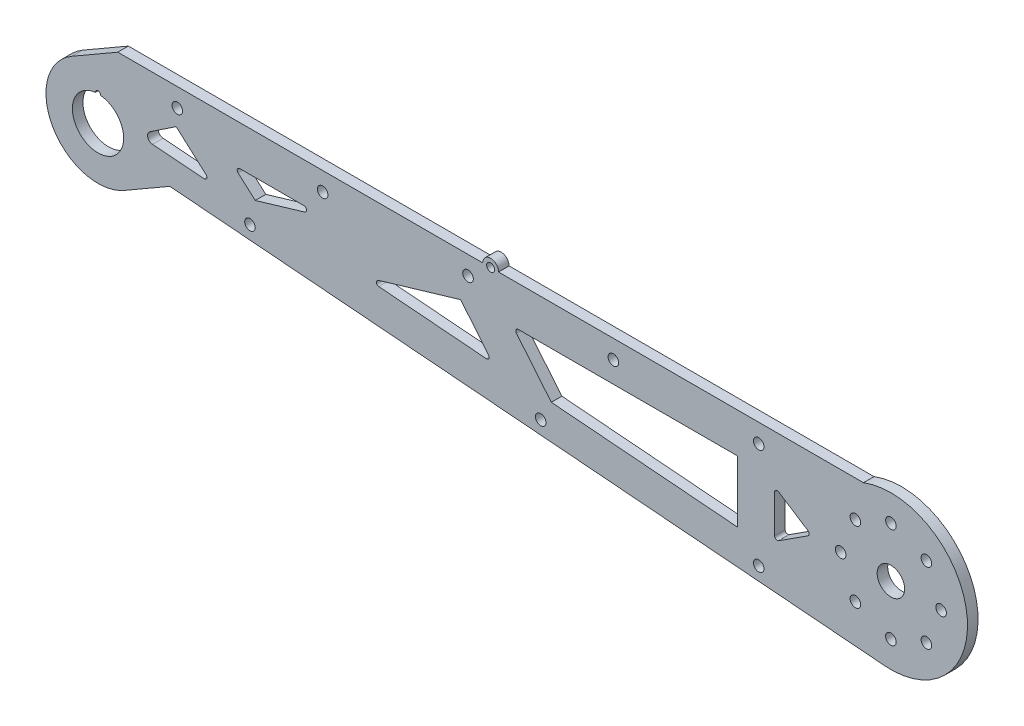
from build123d import *

# Parameters (mm, degrees)
SKETCH_1_R          = 9.7
SKETCH_1_R_2        = 5.2
SKETCH_1_R_3        = 2
EXTRUDE_1_DEPTH     = 4
CUT_EXTRUDE_1_DEPTH = 10
SKETCH_3_R          = 3
EXTRUDE_2_DEPTH     = 4
SKETCH_4_R          = 1.5
CUT_EXTRUDE_2_DEPTH = 4
SKETCH_5_R          = 1
CUT_EXTRUDE_3_DEPTH = 10


with BuildPart() as part:
    # 草图1 → 凸台-拉伸1 (new body)
    with BuildSketch(Plane.XY):
        with BuildLine():
            Line((-9.85, 17.060700455), (7.470508076, 27.060700455))
            Line((7.470508076, 27.060700455), (289.624667154, 27.060700455))
            ThreePointArc((289.624667154, 27.060700455), (328.694852344, 4.11311011), (297.66555963, -28.905888469))
            Line((297.66555963, -28.905888469), (27.170508076, -7.060700455))
            Line((27.170508076, -7.060700455), (9.85, -17.060700455))
            ThreePointArc((9.85, -17.060700455), (-17.060700455, -9.85), (-9.85, 17.060700455))
        make_face()
        Circle(SKETCH_1_R, mode=Mode.SUBTRACT)
        with Locations((300, 0)):
            Circle(SKETCH_1_R_2, mode=Mode.SUBTRACT)
        with Locations((319, 0)):
            Circle(SKETCH_1_R_3, mode=Mode.SUBTRACT)
        with Locations((313.435028843, -13.435028843)):
            Circle(SKETCH_1_R_3, mode=Mode.SUBTRACT)
        with Locations((300, -19)):
            Circle(SKETCH_1_R_3, mode=Mode.SUBTRACT)
        with Locations((286.564971157, -13.435028843)):
            Circle(SKETCH_1_R_3, mode=Mode.SUBTRACT)
        with Locations((281, 0)):
            Circle(SKETCH_1_R_3, mode=Mode.SUBTRACT)
        with Locations((286.564971157, 13.435028843)):
            Circle(SKETCH_1_R_3, mode=Mode.SUBTRACT)
        with Locations((300, 19)):
            Circle(SKETCH_1_R_3, mode=Mode.SUBTRACT)
        with Locations((313.435028843, 13.435028843)):
            Circle(SKETCH_1_R_3, mode=Mode.SUBTRACT)
        with Locations((250, 20)):
            Circle(SKETCH_1_R_3, mode=Mode.SUBTRACT)
        with Locations((195, 20)):
            Circle(SKETCH_1_R_3, mode=Mode.SUBTRACT)
        with Locations((140, 20)):
            Circle(SKETCH_1_R_3, mode=Mode.SUBTRACT)
        with Locations((85, 20)):
            Circle(SKETCH_1_R_3, mode=Mode.SUBTRACT)
        with Locations((30, 20)):
            Circle(SKETCH_1_R_3, mode=Mode.SUBTRACT)
        with Locations(Location((250, -20, 0), (0, 0, 180))):
            Circle(SKETCH_1_R_3, mode=Mode.SUBTRACT)
        with Locations((167.5, -13.337297667)):
            Circle(SKETCH_1_R_3, mode=Mode.SUBTRACT)
        with Locations((57.5, -4.453694555)):
            Circle(SKETCH_1_R_3, mode=Mode.SUBTRACT)
    extrude(amount=EXTRUDE_1_DEPTH)

    # 草图2 → 切除-拉伸1 (cut)
    with BuildSketch(Plane(origin=(0, 0, 0), x_dir=(-1, 0, 0), z_dir=(0, 0, -1))):
        with BuildLine():
            Line((-137.197603441, 10.82531174), (-106.043706264, 1.591034337))
            ThreePointArc((-106.043706264, 1.591034337), (-105.333274422, 0.528665045), (-106.247395472, -0.364489265))
            Line((-106.247395472, -0.364489265), (-146.939942745, -3.650820533))
            ThreePointArc((-146.939942745, -3.650820533), (-147.907056702, -3.116572023), (-147.791851116, -2.017727835))
            Line((-147.791851116, -2.017727835), (-137.197603441, 10.82531174))
        make_face()
        with BuildLine():
            Line((-242, 12), (-159.091058121, 12))
            ThreePointArc((-159.091058121, 12), (-158.186531194, 11.426416508), (-158.319647694, 10.363662077))
            Line((-158.319647694, 10.363662077), (-171.517559676, -5.635709572))
            Line((-171.517559676, -5.635709572), (-242, -11.327873446))
            Line((-242, -11.327873446), (-242, 12))
        make_face()
        with BuildLine():
            Line((-77.967218715, 12), (-53.665101582, 12))
            ThreePointArc((-53.665101582, 12), (-52.730413268, 11.355468359), (-53.000597339, 10.252715509))
            Line((-53.000597339, 10.252715509), (-59.49167188, 4.480688084))
            Line((-59.49167188, 4.480688084), (-78.251405867, 10.041231173))
            ThreePointArc((-78.251405867, 10.041231173), (-78.956857242, 11.14358129), (-77.967218715, 12))
        make_face()
        with BuildLine():
            Line((-268.630020148, 0.840296648), (-257.54212687, 7.993776182))
            ThreePointArc((-257.54212687, 7.993776182), (-256.52152684, 8.031581712), (-256, 7.153479534))
            Line((-256, 7.153479534), (-256, -7.153479534))
            ThreePointArc((-256, -7.153479534), (-256.52152684, -8.031581712), (-257.54212687, -7.993776182))
            Line((-257.54212687, -7.993776182), (-268.630020148, -0.840296648))
            ThreePointArc((-268.630020148, -0.840296648), (-269.087893278, 0), (-268.630020148, 0.840296648))
        make_face()
        with BuildLine():
            Line((-19.631707517, 7.078552885), (-29.56189752, 13.698679554))
            Line((-29.56189752, 13.698679554), (-40.860283753, 3.651869157))
            ThreePointArc((-40.860283753, 3.651869157), (-41.116034111, 2.513264507), (-40.118555254, 1.907570918))
            Line((-40.118555254, 1.907570918), (-20.586659398, 3.4204248))
            ThreePointArc((-20.586659398, 3.4204248), (-18.805958358, 4.909282805), (-19.631707517, 7.078552885))
        make_face()
    extrude(amount=-CUT_EXTRUDE_1_DEPTH, mode=Mode.SUBTRACT)

    # 草图3 → 凸台-拉伸2 (add)
    with BuildSketch(Plane(origin=(0, 0, 0), x_dir=(-1, 0, 0), z_dir=(0, 0, -1))):
        with Locations((-148.547587615, 27.060700455)):
            Circle(SKETCH_3_R)
    extrude(amount=-EXTRUDE_2_DEPTH)

    # 草图4 → 切除-拉伸2 (cut)
    with BuildSketch(Plane(origin=(0, 0, 0), x_dir=(-1, 0, 0), z_dir=(0, 0, -1))):
        with Locations((-148.547587615, 27.060700455)):
            Circle(SKETCH_4_R)
    extrude(amount=-CUT_EXTRUDE_2_DEPTH, mode=Mode.SUBTRACT)

    # 草图5 → 切除-拉伸3 (cut)
    with BuildSketch(Plane(origin=(0, 0, 0), x_dir=(-1, 0, 0), z_dir=(0, 0, -1))):
        with Locations((0, 9.7)):
            Circle(SKETCH_5_R)
    extrude(amount=-CUT_EXTRUDE_3_DEPTH, mode=Mode.SUBTRACT)


solid = part.part
